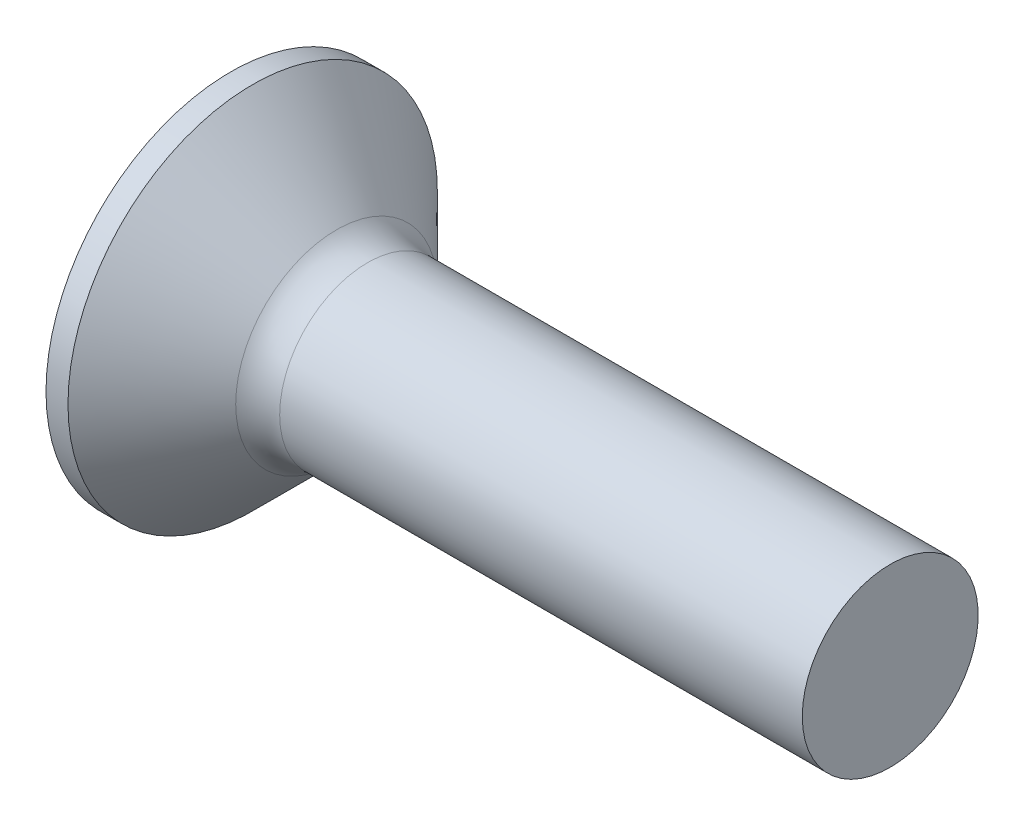
from build123d import *

# Parameters (mm, degrees)
FILLET1_R    = 1
RECPAT_COUNT = 2
RECPAT_ANGLE = 90


with BuildPart() as part:
    # BodySke → Base-Revolve (revolve)
    with BuildSketch(Plane.XY, mode=Mode.PRIVATE) as base_revolve_sk:
        Polygon((0, 0), (0, 4.2), (0.5, 4.2), (2.7, 2), (15, 2), (15, 0), align=None)
    revolve(base_revolve_sk.sketch.rotate(Axis((-6.35, 0, 0), (1, 0, 0)), 90), axis=Axis((-6.35, 0, 0), (1, 0, 0)))

    # Fillet1
    fillet1_edges = [part.edges().sort_by_distance(p)[0] for p in [
        (2.7, 0, -2),
    ]]
    fillet(fillet1_edges, radius=FILLET1_R)

    # Sketch3 → Recess section 0
    with BuildSketch(Plane.ZY):
        with BuildLine():
            Line((-0.515, 2.2), (0.515, 2.2))
            Line((0.515, 2.2), (0.515, -2.2))
            Line((0.515, -2.2), (-0.515, -2.2))
            Line((-0.515, -2.2), (-0.515, 2.2))
        make_face()
    # Sketch4 → Recess section 1
    with BuildSketch(Plane.ZY.offset(-2.51)):
        with BuildLine():
            Line((-0.515, 0.948560373), (0.515, 0.948560373))
            Line((0.515, 0.948560373), (0.515, -0.948560373))
            Line((0.515, -0.948560373), (-0.515, -0.948560373))
            Line((-0.515, -0.948560373), (-0.515, 0.948560373))
        make_face()
    recess = loft(mode=Mode.SUBTRACT)

    # RecPat: Recess ×2 about axis
    recpat_axis = Axis((0, 0, 0), (1, 0, 0))
    for i in range(1, RECPAT_COUNT):
        add(recess.rotate(recpat_axis, i * RECPAT_ANGLE / (RECPAT_COUNT - 1)), mode=Mode.SUBTRACT)

    # RecCorSke → RecessCore (revolve, cut)
    with BuildSketch(Plane.XY, mode=Mode.PRIVATE) as recesscore_sk:
        Polygon((0, 0), (0, 1.026516298), (2.51, 0.851), (2.786506661, 0), align=None)
    revolve(recesscore_sk.sketch.rotate(Axis((-3.175, 0, 0), (1, 0, 0)), 90), axis=Axis((-3.175, 0, 0), (1, 0, 0)), mode=Mode.SUBTRACT)


solid = part.part
